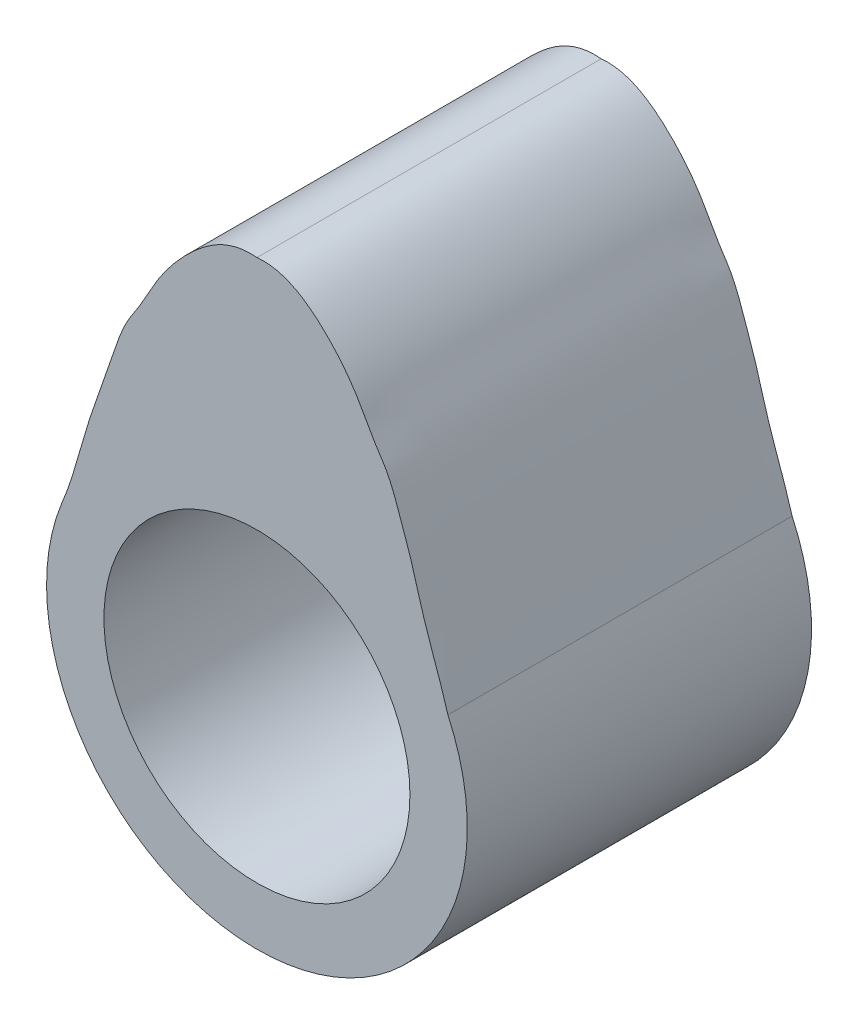
from build123d import *

# Parameters (mm, degrees)
SKETCH_1_R      = 8
EXTRUDE_1_DEPTH = 18


with BuildPart() as part:
    # Эскиз1 → Бобышка-Вытянуть1 (new body)
    # profile 1 of 2: a face of its own
    with BuildSketch(Plane.XY):
        with BuildLine():
            ThreePointArc((-10.100042175, 4.357653964), (-0.139043679, 10.999121186), (9.986659039, 4.611576872))
            add(Edge.make_bspline(
                [(0, 20.328552603), (1.382874881, 20.471678841), (3.387437685, 19.140957741), (5.149203969, 16.937361824), (6.019843488, 15.189591781), (6.94726478, 13.901122152), (7.481940513, 12.301028666), (8.123645702, 10.548388164), (8.7922779, 7.928692427), (9.588098387, 5.99820489), (9.986659039, 4.611576872)],
                knots=[0, 0, 0, 0, 0.197957329, 0.347933103, 0.427687734, 0.494984692, 0.588497983, 0.682566948, 0.780100182, 1, 1, 1, 1], degree=3))
            add(Edge.make_bspline(
                [(0, 20.328552603), (-1.382825366, 20.471663096), (-3.387593877, 19.141007408), (-5.148912185, 16.937269039), (-6.020348908, 15.189752499), (-6.94541903, 13.900535223), (-7.491989169, 12.304224029), (-8.089155155, 10.526036811), (-9.05396332, 7.903603604), (-9.530122855, 5.775128018), (-10.100042175, 4.357653964)],
                knots=[0, 0, 0, 0, 0.192274789, 0.337945376, 0.41541058, 0.48077572, 0.571604629, 0.662973262, 0.759317857, 0.984960565, 0.984960565, 0.984960565, 0.984960565], degree=3))
        make_face()
    # profile 2 of 2: a face of its own
    with BuildSketch(Plane.XY):
        with BuildLine():
            ThreePointArc((-10.217258553, 4.075245718), (-2.074868178, -10.802542388), (11, 0))
            ThreePointArc((11, 0), (10.74367836, 2.360799714), (9.986659039, 4.611576872))
            ThreePointArc((9.986659039, 4.611576872), (-0.139043679, 10.999121186), (-10.100042175, 4.357653964))
            add(Edge.make_bspline(
                [(-10.100042175, 4.357653964), (-10.138028177, 4.26317713), (-10.177063639, 4.169029578), (-10.217258553, 4.075245718)],
                knots=[0.984960565, 0.984960565, 0.984960565, 0.984960565, 1, 1, 1, 1], degree=3))
        make_face()
        Circle(SKETCH_1_R, mode=Mode.SUBTRACT)
    extrude(amount=EXTRUDE_1_DEPTH)


solid = part.part
